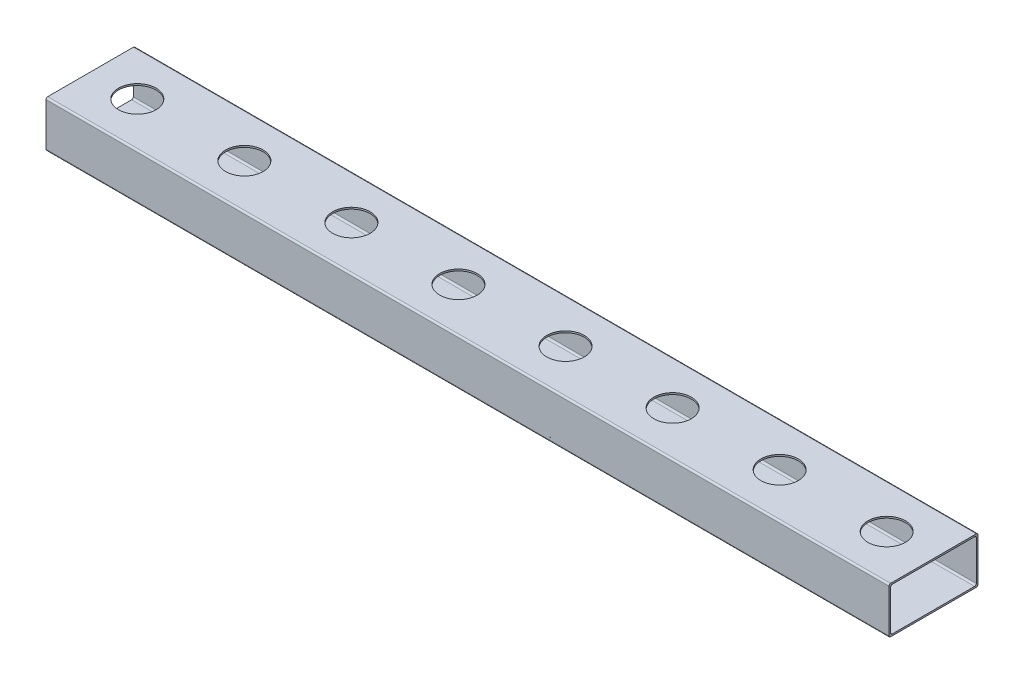
from build123d import *

# Parameters (mm, degrees)
BOSS_EXTRUDE1_DEPTH              = 500
F_0_15_44_5_DIAMETER_HOLE1_D     = 44.5
F_0_15_44_5_DIAMETER_HOLE1_DEPTH = 2


with BuildPart() as part:
    # Sketch1 → Boss-Extrude1 (new, symmetric)
    with BuildSketch(Plane(origin=(0, 0, 0), x_dir=(0, 0, -1), z_dir=(1, 0, 0))):
        with BuildLine():
            Line((-50.85, -27.5), (50.85, -27.5))
            ThreePointArc((50.85, -27.5), (52.264213562, -26.914213562), (52.85, -25.5))
            Line((52.85, -25.5), (52.85, 25.5))
            ThreePointArc((52.85, 25.5), (52.264213562, 26.914213562), (50.85, 27.5))
            Line((50.85, 27.5), (-50.85, 27.5))
            ThreePointArc((-50.85, 27.5), (-52.264213562, 26.914213562), (-52.85, 25.5))
            Line((-52.85, 25.5), (-52.85, -25.5))
            ThreePointArc((-52.85, -25.5), (-52.264213562, -26.914213562), (-50.85, -27.5))
        make_face()
        with BuildLine():
            Line((-48.85, 25.5), (48.85, 25.5))
            ThreePointArc((48.85, 25.5), (50.264213562, 24.914213562), (50.85, 23.5))
            Line((50.85, 23.5), (50.85, -23.5))
            ThreePointArc((50.85, -23.5), (50.264213562, -24.914213562), (48.85, -25.5))
            Line((48.85, -25.5), (-48.85, -25.5))
            ThreePointArc((-48.85, -25.5), (-50.264213562, -24.914213562), (-50.85, -23.5))
            Line((-50.85, -23.5), (-50.85, 23.5))
            ThreePointArc((-50.85, 23.5), (-50.264213562, 24.914213562), (-48.85, 25.5))
        make_face(mode=Mode.SUBTRACT)
    extrude(amount=BOSS_EXTRUDE1_DEPTH, both=True)

    # Ø0.15 (44.5) Diameter Hole1
    with Locations(Plane(origin=(0, 27.5, 0), x_dir=(1, 0, 0), z_dir=(0, 1, 0))):
        with Locations((-444.5, 0), (-317.5, 0), (-190.5, 0), (-63.5, 0), (63.5, 0), (190.5, 0), (317.5, 0), (444.5, 0)):
            Hole(F_0_15_44_5_DIAMETER_HOLE1_D / 2, depth=F_0_15_44_5_DIAMETER_HOLE1_DEPTH)


solid = part.part
